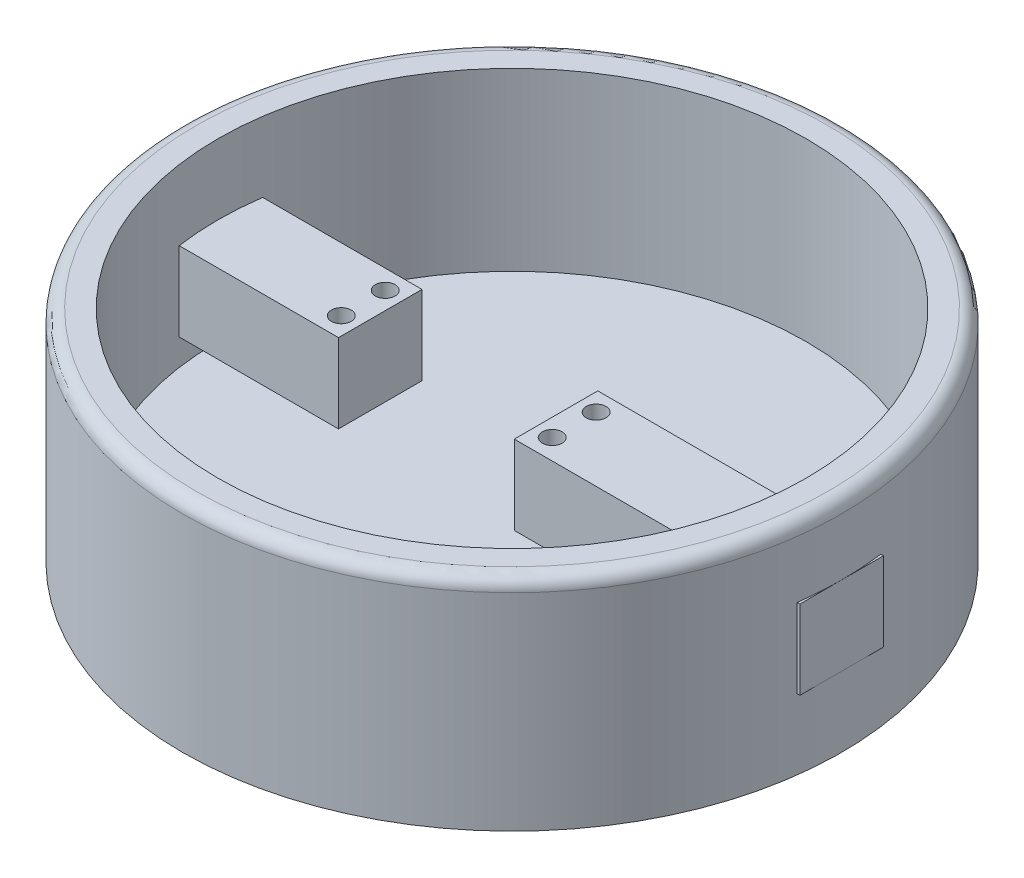
from build123d import *

# Parameters (mm, degrees)
SKETCH1_R           = 75
BOSS_EXTRUDE3_DEPTH = 10
SKETCH1_4_R         = 75
SKETCH1_4_R_2       = 66.925057636
BOSS_EXTRUDE4_DEPTH = 50
SKETCH3_W           = 19
SKETCH3_H           = 18
BOSS_EXTRUDE5_DEPTH = 65
SKETCH4_W           = 19
SKETCH4_H           = 18
BOSS_EXTRUDE6_DEPTH = 45
SKETCH5_R           = 2.25
CUT_EXTRUDE1_DEPTH  = 15
FILLET2_R           = 3


with BuildPart() as part:
    # Sketch1 → Boss-Extrude3 (new body)
    with BuildSketch(Plane(origin=(0, 0, 0), x_dir=(1, 0, 0), z_dir=(0, 1, 0))):
        Circle(SKETCH1_R)
    extrude(amount=BOSS_EXTRUDE3_DEPTH)

    # Sketch1<4> → Boss-Extrude4 (add)
    with BuildSketch(Plane(origin=(0, 0, 0), x_dir=(1, 0, 0), z_dir=(0, 1, 0))):
        Circle(SKETCH1_4_R)
        Circle(SKETCH1_4_R_2, mode=Mode.SUBTRACT)
    extrude(amount=BOSS_EXTRUDE4_DEPTH)

    # Sketch3 → Boss-Extrude5 (add)
    with BuildSketch(Plane(origin=(75, 50, 0), x_dir=(0, 0, -1), z_dir=(1, 0, 0))):
        with Locations((0, -25)):
            Rectangle(SKETCH3_W, SKETCH3_H)
    extrude(amount=-BOSS_EXTRUDE5_DEPTH)

    # Sketch4 → Boss-Extrude6 (add)
    with BuildSketch(Plane(origin=(-75, 50, 0), x_dir=(0, 0, 1), z_dir=(-1, 0, 0))):
        with Locations((0, -25)):
            Rectangle(SKETCH4_W, SKETCH4_H)
    extrude(amount=-BOSS_EXTRUDE6_DEPTH)

    # Sketch5 → Cut-Extrude1 (cut)
    with BuildSketch(Plane(origin=(0, 34, 0), x_dir=(1, 0, 0), z_dir=(0, 1, 0))):
        with Locations((14, 5.130777808)):
            Circle(SKETCH5_R)
        with Locations((14, -4.869222192)):
            Circle(SKETCH5_R)
        with Locations((-34, 5.130777808)):
            Circle(SKETCH5_R)
        with Locations((-34, -4.869222192)):
            Circle(SKETCH5_R)
    extrude(amount=-CUT_EXTRUDE1_DEPTH, mode=Mode.SUBTRACT)

    # Fillet2
    fillet2_edges = [part.edges().sort_by_distance(p)[0] for p in [
        (-75, 50, 0),
    ]]
    fillet(fillet2_edges, radius=FILLET2_R)


solid = part.part
